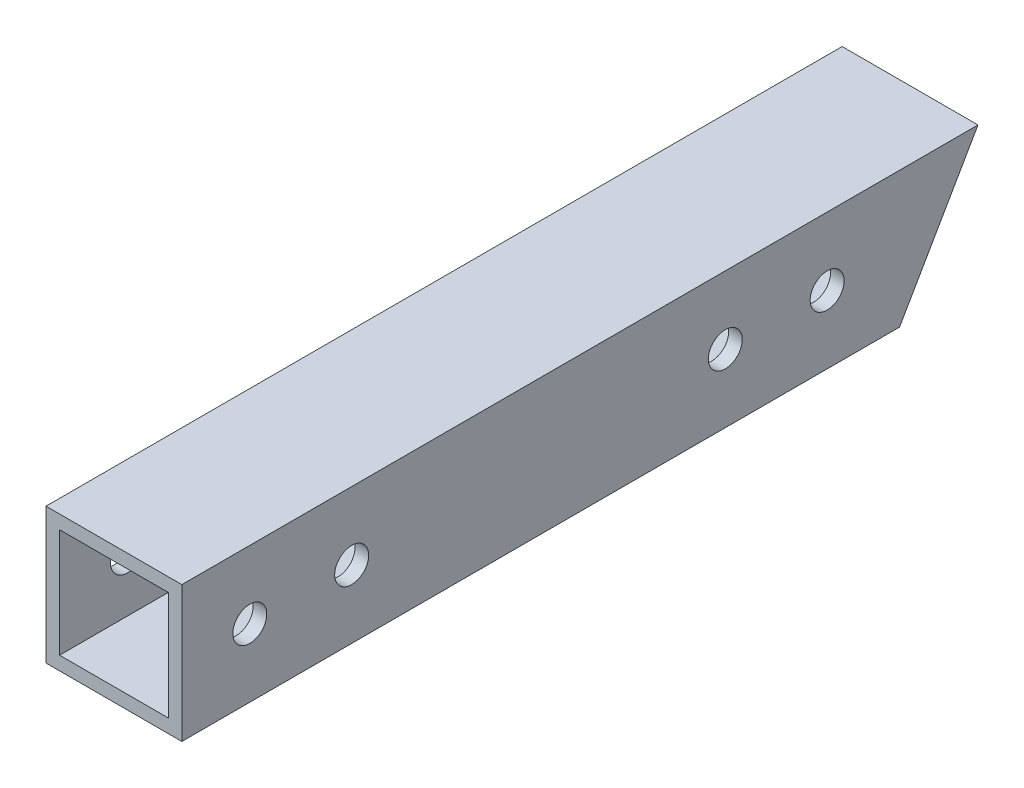
from build123d import *

# Parameters (mm, degrees)
SKETCH1_W           = 20
SKETCH1_H           = 20
SKETCH1_W_2         = 16
SKETCH1_H_2         = 16
BOSS_EXTRUDE1_DEPTH = 100
SKETCH4_R           = 2.5
CUT_EXTRUDE2_DEPTH  = 103.46950766
SKETCH5_W           = 20
SKETCH5_H           = 20
SKETCH5_W_2         = 16
SKETCH5_H_2         = 16
BOSS_EXTRUDE2_DEPTH = 12.3
BOSS_EXTRUDE3_DEPTH = 20
SKETCH7_W           = 16
SKETCH7_H           = 16
CUT_EXTRUDE3_DEPTH  = 114.186969215
CUT_EXTRUDE4_DEPTH  = 103.46950766


with BuildPart() as part:
    # Sketch1 → Boss-Extrude1 (new body)
    with BuildSketch(Plane.XY):
        Rectangle(SKETCH1_W, SKETCH1_H)
        Rectangle(SKETCH1_W_2, SKETCH1_H_2, mode=Mode.SUBTRACT)
    extrude(amount=BOSS_EXTRUDE1_DEPTH)

    # Sketch4 → Cut-Extrude2 (cut, through all)
    with BuildSketch(Plane(origin=(10, 0, 0), x_dir=(0, 0, -1), z_dir=(1, 0, 0))):
        with Locations((-90, 0)):
            Circle(SKETCH4_R)
        with Locations((-75, 0)):
            Circle(SKETCH4_R)
        with Locations((-5, 0)):
            Circle(SKETCH4_R)
        with Locations((-20, 0)):
            Circle(SKETCH4_R)
    extrude(amount=-CUT_EXTRUDE2_DEPTH, mode=Mode.SUBTRACT)

    # Sketch5 → Boss-Extrude2 (add)
    with BuildSketch(Plane(origin=(0, 0, 0), x_dir=(-1, 0, 0), z_dir=(0, 0, -1))):
        Rectangle(SKETCH5_W, SKETCH5_H)
        Rectangle(SKETCH5_W_2, SKETCH5_H_2, mode=Mode.SUBTRACT)
    extrude(amount=BOSS_EXTRUDE2_DEPTH)

    # Sketch6 → Boss-Extrude3 (add)
    with BuildSketch(Plane.ZY.offset(10)):
        Polygon((-12.3, 10), (-12.3, 1.5), (-17.207477288, 10), align=None)
    extrude(amount=-BOSS_EXTRUDE3_DEPTH)

    # Sketch7 → Cut-Extrude3 (cut, through all)
    with BuildSketch(Plane.XY.offset(-12.3)):
        Rectangle(SKETCH7_W, SKETCH7_H)
    extrude(amount=-CUT_EXTRUDE3_DEPTH, mode=Mode.SUBTRACT)

    # Sketch8 → Cut-Extrude4 (cut, through all)
    with BuildSketch(Plane.ZY.offset(10)):
        Polygon((-17.207477288, 10), (-5.660471904, -10), (-17.207477288, -10), align=None)
    extrude(amount=-CUT_EXTRUDE4_DEPTH, mode=Mode.SUBTRACT)


solid = part.part
